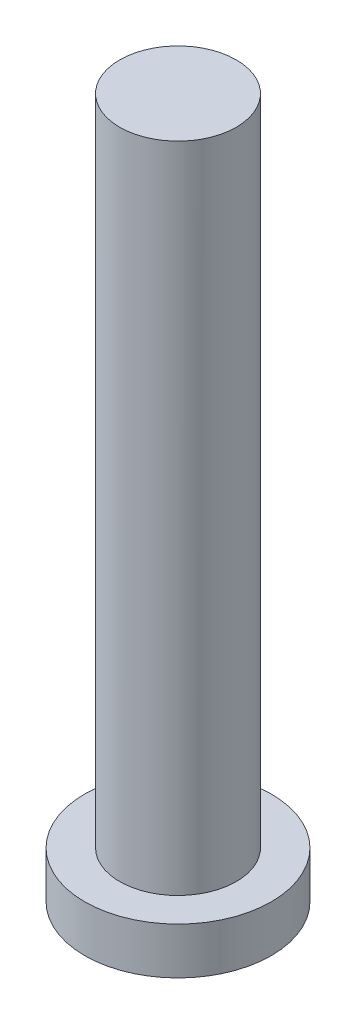
from build123d import *

# Parameters (mm, degrees)
SKETCH2_R           = 1.25
BOSS_EXTRUDE1_DEPTH = 14
SKETCH3_R           = 2
BOSS_EXTRUDE2_DEPTH = 1


with BuildPart() as part:
    # Sketch2 → Boss-Extrude1 (new body)
    with BuildSketch(Plane(origin=(0, 0, 0), x_dir=(1, 0, 0), z_dir=(0, 1, 0))):
        with Locations(Location((0, 0, 0), (0, 0, 270))):
            Circle(SKETCH2_R)
    extrude(amount=BOSS_EXTRUDE1_DEPTH)

    # Sketch3 → Boss-Extrude2 (add)
    with BuildSketch(Plane.XZ):
        with Locations(Location((0, 0, 0), (0, 0, 270))):
            Circle(SKETCH3_R)
    extrude(amount=BOSS_EXTRUDE2_DEPTH)


solid = part.part
